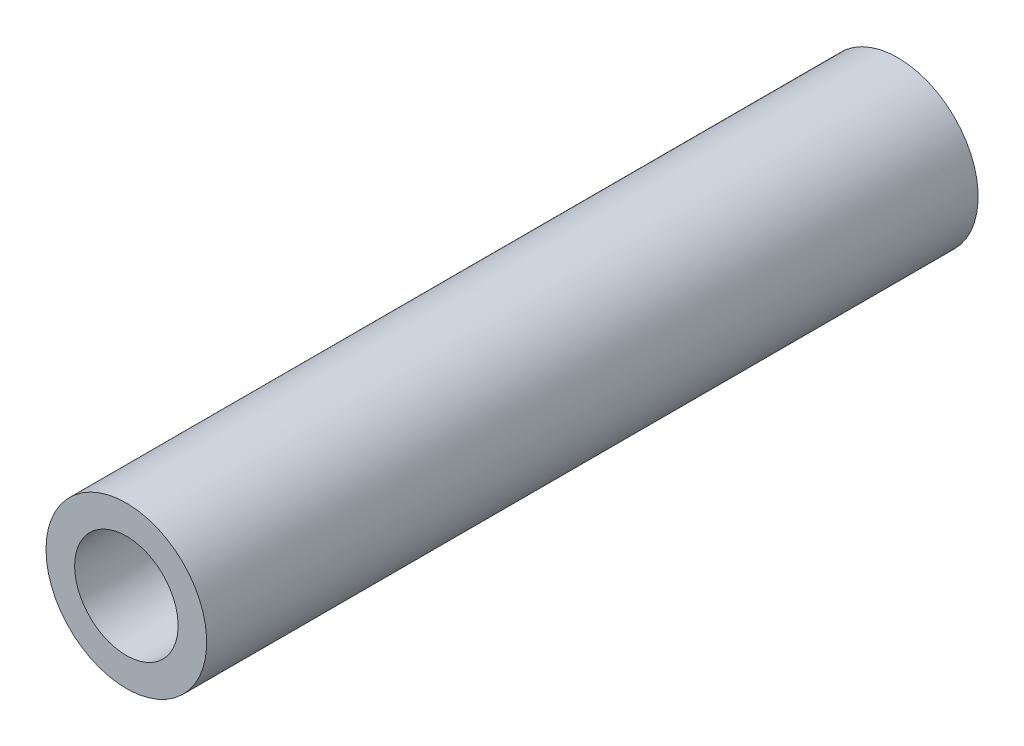
from build123d import *

# Parameters (mm, degrees)
SKETCH1_R           = 3.96875
SKETCH1_R_2         = 2.555
BOSS_EXTRUDE1_DEPTH = 38.1


with BuildPart() as part:
    # Sketch1 → Boss-Extrude1 (new body)
    with BuildSketch(Plane.XY):
        with Locations(Location((0, 0, 0), (0, 0, 180))):
            Circle(SKETCH1_R)
        with Locations(Location((0, 0, 0), (0, 0, 180))):
            Circle(SKETCH1_R_2, mode=Mode.SUBTRACT)
    extrude(amount=BOSS_EXTRUDE1_DEPTH)


solid = part.part
